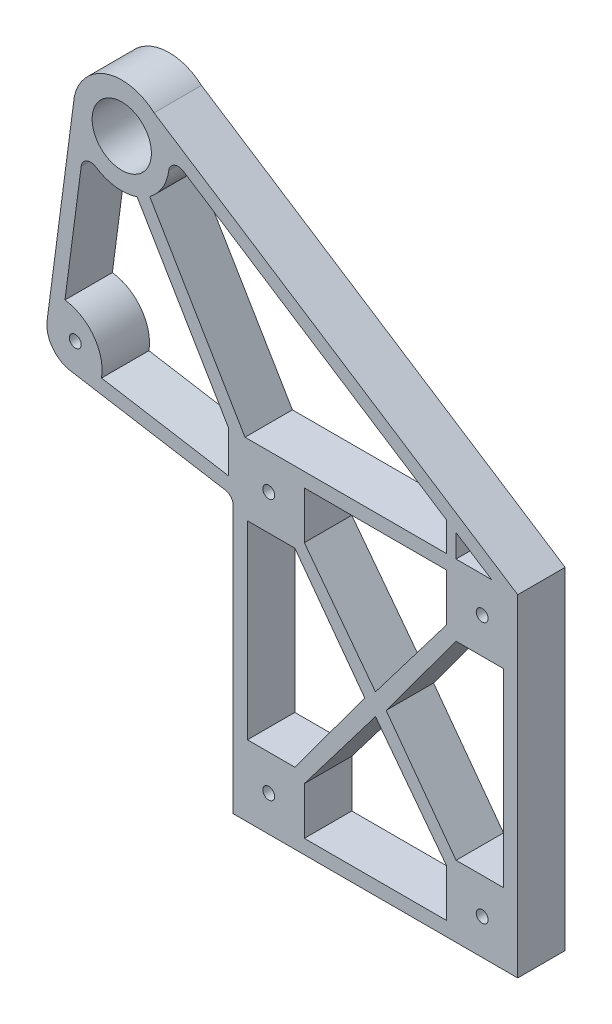
from build123d import *

# Parameters (mm, degrees)
SKETCH1_R           = 7.9375
BOSS_EXTRUDE1_DEPTH = 12.7
CUT_EXTRUDE1_DEPTH  = 12.7
SKETCH3_R           = 1.5875
CUT_EXTRUDE2_DEPTH  = 12.7
CUT_EXTRUDE3_DEPTH  = 12.7
FILLET1_R           = 2.54
BOSS_EXTRUDE2_DEPTH = 12.7
SKETCH6_R           = 1.5875
CUT_EXTRUDE4_DEPTH  = 12.7
FILLET2_R           = 7.62
FILLET3_R           = 2.54


with BuildPart() as part:
    # Sketch1 → Boss-Extrude1 (new body)
    with BuildSketch(Plane.XY):
        with BuildLine():
            Line((0, 0), (76.2, 0))
            Line((76.2, 0), (76.2, 88.9))
            Line((76.2, 88.9), (-21.190795437, 151.964199177))
            ThreePointArc((-21.190795437, 151.964199177), (-33.829972343, 154.632550249), (-42.545, 145.0975))
            Line((-42.545, 145.0975), (-50.8, 82.136361391))
            Line((-50.8, 82.136361391), (0, 73.66))
            Line((0, 73.66), (0, 0))
        make_face()
        with Locations((-29.845, 142.24)):
            Circle(SKETCH1_R, mode=Mode.SUBTRACT)
    extrude(amount=BOSS_EXTRUDE1_DEPTH)

    # Sketch2 → Cut-Extrude1 (cut)
    with BuildSketch(Plane.XY.offset(12.7)):
        Polygon((19.05, 3.81), (57.15, 3.81), (57.15, 16.51), (38.1, 41.5925), (19.05, 16.51), align=None)
        Polygon((3.81, 19.05), (16.51, 19.05), (35.2425, 44.45), (16.51, 69.85), (3.81, 69.85), align=None)
        Polygon((19.05, 85.09), (19.05, 72.39), (38.1, 47.3075), (57.15, 72.39), (57.15, 85.09), align=None)
        Polygon((72.39, 69.85), (59.69, 69.85), (40.9575, 44.45), (59.69, 19.05), (72.39, 19.05), align=None)
    extrude(amount=-CUT_EXTRUDE1_DEPTH, mode=Mode.SUBTRACT)

    # Sketch3 → Cut-Extrude2 (cut)
    with BuildSketch(Plane.XY.offset(12.7)):
        with Locations((66.675, 79.375)):
            Circle(SKETCH3_R)
        with Locations((9.525, 79.375)):
            Circle(SKETCH3_R)
        with Locations((9.525, 9.525)):
            Circle(SKETCH3_R)
        with Locations((66.675, 9.525)):
            Circle(SKETCH3_R)
    extrude(amount=-CUT_EXTRUDE2_DEPTH, mode=Mode.SUBTRACT)

    # Sketch4 → Cut-Extrude3 (cut)
    with BuildSketch(Plane.XY.offset(12.7)):
        with BuildLine():
            Line((69.190325437, 88.9), (-17.449031417, 145.002238745))
            ThreePointArc((-17.449031417, 145.002238745), (-17.963027163, 137.755725085), (-22.364956463, 131.976523558))
            Line((-22.364956463, 131.976523558), (3.158582938, 88.9))
            Line((3.158582938, 88.9), (69.190325437, 88.9))
        make_face()
        with BuildLine():
            Line((-40.065465421, 134.701294104), (-45.058154169, 96.621903635))
            ThreePointArc((-45.058154169, 96.621903635), (-37.359379788, 92.092328445), (-35.269920717, 83.407724876))
            Line((-35.269920717, 83.407724876), (-1.27, 77.734582843))
            Line((-1.27, 77.734582843), (-1.27, 88.9))
            Line((-1.27, 88.9), (-25.751473381, 130.217810523))
            ThreePointArc((-25.751473381, 130.217810523), (-33.641083643, 130.12060443), (-40.065465421, 134.701294104))
        make_face()
    extrude(amount=-CUT_EXTRUDE3_DEPTH, mode=Mode.SUBTRACT)

    # Fillet1
    fillet1_edges = [part.edges().sort_by_distance(p)[0] for p in [
        (-17.449031417, 145.002238745, 6.35),
        (-40.065465421, 134.701294104, 6.35),
    ]]
    fillet(fillet1_edges, radius=FILLET1_R)

    # Sketch5 → Boss-Extrude2 (add)
    with BuildSketch(Plane.XY.offset(12.7)):
        Polygon((57.125325437, 88.9), (59.665325437, 88.9), (59.665325437, 95.06779537), (57.125325437, 96.712540802), align=None)
    extrude(amount=-BOSS_EXTRUDE2_DEPTH)

    # Sketch6 → Cut-Extrude4 (cut)
    with BuildSketch(Plane.XY.offset(12.7)):
        with Locations((-42.288108338, 88.441435979)):
            Circle(SKETCH6_R)
    extrude(amount=-CUT_EXTRUDE4_DEPTH, mode=Mode.SUBTRACT)

    # Fillet2
    fillet2_edges = [part.edges().sort_by_distance(p)[0] for p in [
        (-50.8, 82.136361391, 6.35),
    ]]
    fillet(fillet2_edges, radius=FILLET2_R)

    # Fillet3
    fillet3_edges = [part.edges().sort_by_distance(p)[0] for p in [
        (0, 73.66, 6.35),
    ]]
    fillet(fillet3_edges, radius=FILLET3_R)


solid = part.part
